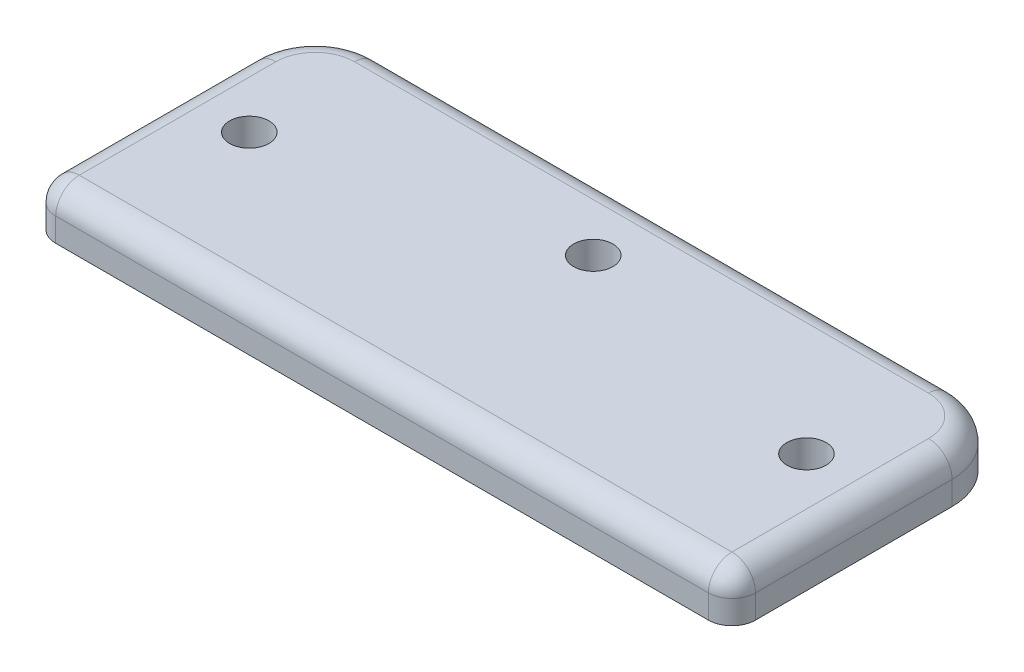
from build123d import *

# Parameters (mm, degrees)
SKETCH1_R           = 2.5
BOSS_EXTRUDE1_DEPTH = 6
FILLET1_R           = 3


with BuildPart() as part:
    # Sketch1 → Boss-Extrude1 (new body)
    with BuildSketch(Plane(origin=(0, 0, 0), x_dir=(1, 0, 0), z_dir=(0, 1, 0))):
        with BuildLine():
            Line((-36.5, 18), (36.5, 18))
            ThreePointArc((36.5, 18), (42.156854249, 15.656854249), (44.5, 10))
            Line((44.5, 10), (44.5, -15))
            ThreePointArc((44.5, -15), (43.621320344, -17.121320344), (41.5, -18))
            Line((41.5, -18), (-41.5, -18))
            ThreePointArc((-41.5, -18), (-43.621320344, -17.121320344), (-44.5, -15))
            Line((-44.5, -15), (-44.5, 10))
            ThreePointArc((-44.5, 10), (-42.156854249, 15.656854249), (-36.5, 18))
        make_face()
        with Locations(Location((0, 8.86, 0), (0, 0, 270))):
            Circle(SKETCH1_R, mode=Mode.SUBTRACT)
        with Locations(Location((35.43, 0.55, 0), (0, 0, 270))):
            Circle(SKETCH1_R, mode=Mode.SUBTRACT)
        with Locations(Location((-35.43, 0.55, 0), (0, 0, 90))):
            Circle(SKETCH1_R, mode=Mode.SUBTRACT)
    extrude(amount=BOSS_EXTRUDE1_DEPTH)

    # Fillet1
    fillet1_edges = [part.edges().sort_by_distance(p)[0] for p in [
        (-42.156854249, 6, -15.656854249),
        (-44.5, 6, 2.5),
        (-43.621320344, 6, 17.121320344),
        (0, 6, 18),
        (43.621320344, 6, 17.121320344),
        (44.5, 6, 2.5),
        (42.156854249, 6, -15.656854249),
        (0, 6, -18),
    ]]
    fillet(fillet1_edges, radius=FILLET1_R)


solid = part.part
